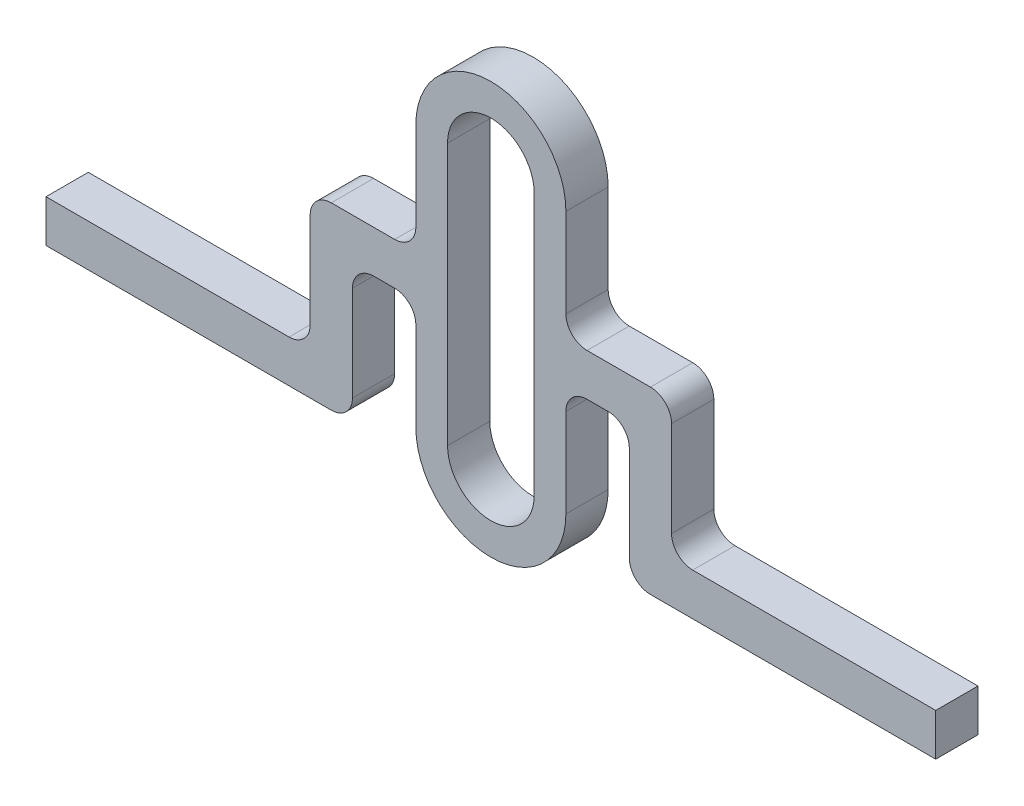
from build123d import *

# Parameters (mm, degrees)
BOSS_EXTRUDE1_DEPTH = 2
SKETCH2_W           = 4
SKETCH2_H           = 4
BOSS_EXTRUDE2_DEPTH = 10
SKETCH4_W           = 4
SKETCH4_H           = 4
BOSS_EXTRUDE4_DEPTH = 13
SKETCH5_W           = 4
SKETCH5_H           = 4
BOSS_EXTRUDE5_DEPTH = 25
FILLET2_R           = 2


with BuildPart() as part:
    # Sketch1 → Boss-Extrude1 (new, symmetric)
    with BuildSketch(Plane.XY):
        with BuildLine():
            Line((-7.1, -12.4), (-7.1, 12.4))
            ThreePointArc((-7.1, 12.4), (0, 19.5), (7.1, 12.4))
            Line((7.1, 12.4), (7.1, -12.4))
            ThreePointArc((7.1, -12.4), (0, -19.5), (-7.1, -12.4))
        make_face()
        with BuildLine():
            Line((-4.1, -12.4), (-4.1, 12.4))
            ThreePointArc((-4.1, 12.4), (0, 16.5), (4.1, 12.4))
            Line((4.1, 12.4), (4.1, -12.4))
            ThreePointArc((4.1, -12.4), (0, -16.5), (-4.1, -12.4))
        make_face(mode=Mode.SUBTRACT)
    extrude(amount=BOSS_EXTRUDE1_DEPTH, both=True)

    # Sketch2 → Boss-Extrude2 (add)
    with BuildSketch(Plane(origin=(7.1, 0, 0), x_dir=(0, 0, -1), z_dir=(1, 0, 0))):
        Rectangle(SKETCH2_W, SKETCH2_H)
    boss_extrude2 = extrude(amount=BOSS_EXTRUDE2_DEPTH)

    # Sketch4 → Boss-Extrude4 (add)
    with BuildSketch(Plane.XZ.offset(2)):
        with Locations((15.1, 0)):
            Rectangle(SKETCH4_W, SKETCH4_H)
    boss_extrude4 = extrude(amount=BOSS_EXTRUDE4_DEPTH)

    # Sketch5 → Boss-Extrude5 (add)
    with BuildSketch(Plane(origin=(17.1, 0, 0), x_dir=(0, 0, -1), z_dir=(1, 0, 0))):
        with Locations((0, -13)):
            Rectangle(SKETCH5_W, SKETCH5_H)
    boss_extrude5 = extrude(amount=BOSS_EXTRUDE5_DEPTH)

    # Mirror2: Boss-Extrude2, Boss-Extrude4, Boss-Extrude5 across plane
    add(boss_extrude2.mirror(Plane(origin=(0, 0, 0), x_dir=(0, 0, 1), z_dir=(1, 0, 0))))
    add(boss_extrude4.mirror(Plane(origin=(0, 0, 0), x_dir=(0, 0, 1), z_dir=(1, 0, 0))))
    add(boss_extrude5.mirror(Plane(origin=(0, 0, 0), x_dir=(0, 0, 1), z_dir=(1, 0, 0))))

    # Fillet2
    fillet2_edges = [part.edges().sort_by_distance(p)[0] for p in [
        (7.1, 2, 0),
        (7.1, -2, 0),
        (17.1, 2, 0),
        (13.1, -2, 0),
        (13.1, -15, 0),
        (17.1, -11, 0),
        (-17.1, 2, 0),
        (-7.1, 2, 0),
        (-7.1, -2, 0),
        (-13.1, -15, 0),
        (-13.1, -2, 0),
        (-17.1, -11, 0),
    ]]
    fillet(fillet2_edges, radius=FILLET2_R)


solid = part.part
